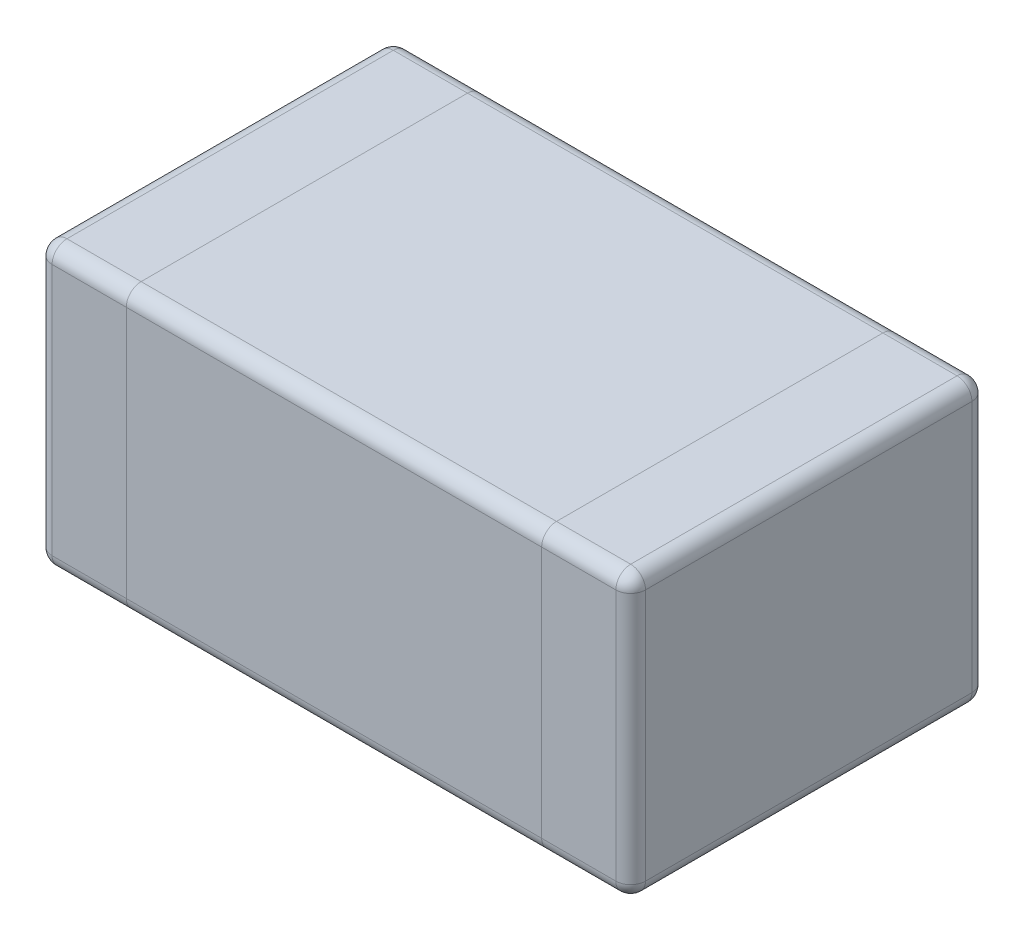
from build123d import *

# Parameters (mm, degrees)
SKETCH1_W      = 2
SKETCH1_H      = 1.2
EXTRUDE1_DEPTH = 0.95
FILLET1_R      = 0.05


with BuildPart() as part:
    # Sketch1 → Extrude1 (new body)
    with BuildSketch(Plane(origin=(0, 0, 0), x_dir=(1, 0, 0), z_dir=(0, 1, 0))):
        Rectangle(SKETCH1_W, SKETCH1_H)
    extrude(amount=EXTRUDE1_DEPTH)

    # Fillet1
    fillet1_edges = [part.edges().sort_by_distance(p)[0] for p in [
        (-1, 0.95, 0),
        (0, 0.95, 0.6),
        (1, 0.95, 0),
        (0, 0, 0.6),
        (-1, 0, 0),
        (0, 0, -0.6),
        (1, 0, 0),
        (0, 0.95, -0.6),
        (1, 0.475, 0.6),
        (-1, 0.475, 0.6),
        (-1, 0.475, -0.6),
        (1, 0.475, -0.6),
    ]]
    fillet(fillet1_edges, radius=FILLET1_R)


solid = part.part
